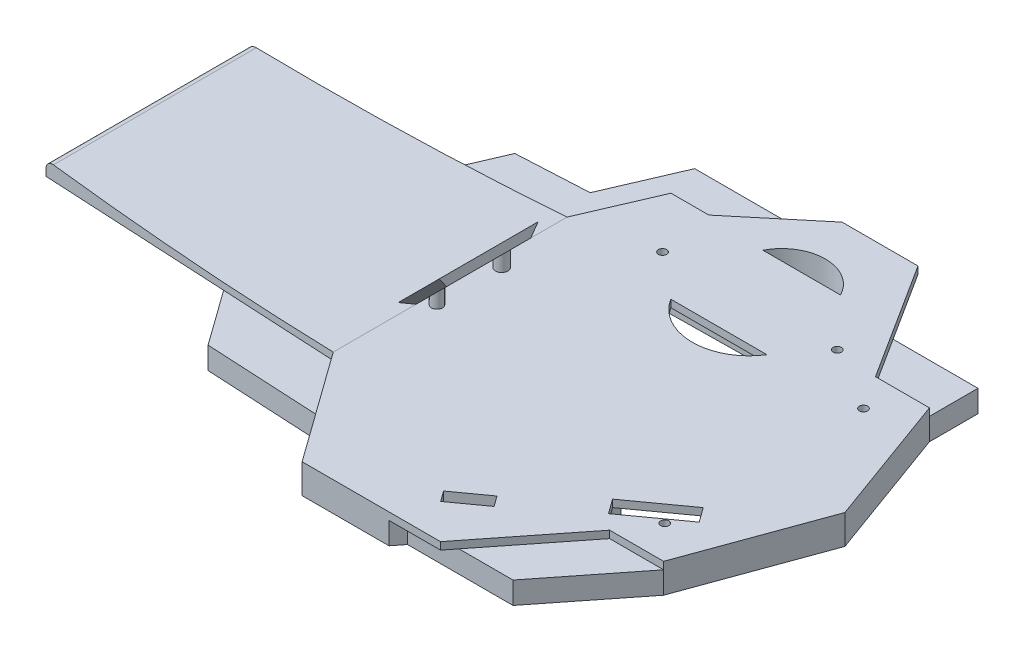
from build123d import *

# Parameters (mm, degrees)
EXTRUDE_1_DEPTH               = 2
EXTRUDE_2_DEPTH               = 2
CUT_EXTRUDE_3_DEPTH           = 202.869395429
CUT_EXTRUDE_3_DEPTH_BACK      = 202.869395429
FILLET_1_R                    = 2
EXTRUDE_4_DEPTH               = 6
CUT_EXTRUDE_7_DEPTH           = 202.98824919
EXTRUDE_5_DEPTH               = 2
EXTRUDE_5_DRAFT               = -45
EXTRUDE_11_REACH              = 204.137
SKETCH_24_R                   = 1.697293379
SKETCH_24_R_2                 = 1.5
CUT_EXTRUDE_8_DEPTH           = 203.13682253
SKETCH_26_W                   = 1.1303
SKETCH_26_H                   = 10
HOLE_WIZARD_4_40_3_AT_2_COUNT = 2
HOLE_WIZARD_4_40_3_AT_2_PITCH = 54.095245987
SKETCH_29_R                   = 3
EXTRUDE_14_DEPTH              = 5
SKETCH_32_W                   = 1.1303
SKETCH_32_H                   = 8
HOLE_WIZARD_4_40_4_AT_2_COUNT = 2
HOLE_WIZARD_4_40_4_AT_2_PITCH = 46.853089657


with BuildPart() as part:
    # 草图2 → 凸台-拉伸1 (new body)
    with BuildSketch(Plane(origin=(0, 0, 0), x_dir=(1, 0, 0), z_dir=(0, 1, 0))):
        Polygon((141.821582241, 68.082690978), (121.161879345, 68.082690978), (101.35099463, 51.608897425), (91.039832206, 51.608897425), (82.527346571, 31.825074964), (0, 27.5), (0, -27.5), (82.527346571, -31.825074964), (104.14664553, -61.917309022), (141.821582241, -61.917309022), (162.133732132, -36.18552755), (176.829545061, -36.18552755), (190, 0), (176.829545061, 36.18552755), (162.133732132, 36.18552755), align=None)
    extrude(amount=EXTRUDE_1_DEPTH)

    # 草图6 → 凸台-拉伸2 (add)
    with BuildSketch(Plane(origin=(0, 2, 0), x_dir=(1, 0, 0), z_dir=(0, 1, 0))):
        Polygon((82.527346571, 31.825074964), (82.527346571, -31.825074964), (0, -27.5), (0, 27.5), align=None)
    extrude(amount=EXTRUDE_2_DEPTH)

    # 草图7 → 切除-拉伸3 (cut, two sides: drawn at the far end of the back side and taken through both)
    with BuildSketch(Plane.XY.offset(-CUT_EXTRUDE_3_DEPTH_BACK)):
        with BuildLine():
            Line((82.527346571, 2), (82.527346571, 30.740821148))
            Line((82.527346571, 30.740821148), (0, 4))
            add(Edge.make_bspline(
                [(82.527346571, 2), (41.215261335, 1.001172546), (0, 4)],
                knots=[0, 0, 0, 1, 1, 1], degree=2))
        make_face()
    extrude(amount=CUT_EXTRUDE_3_DEPTH + CUT_EXTRUDE_3_DEPTH_BACK, mode=Mode.SUBTRACT)

    # 圆角1
    fillet_1_edges = [part.edges().sort_by_distance(p)[0] for p in [
        (0, 4, 13.75),
    ]]
    fillet(fillet_1_edges, radius=FILLET_1_R)

    # 草图13 → 凸台-拉伸4 (add)
    with BuildSketch(Plane.XZ):
        Polygon((53.501507434, -30.303895193), (58.412275987, -41.716986195), (77.926898746, -42.739704237), (86.484415452, -62.62818317), (136.164724768, -62.62818317), (144.584081331, -49.40685536), (176.829545061, -49.40685536), (176.829545061, -36.18552755), (190, 0), (176.829545061, 36.18552755), (158.743204348, 59.097615602), (130.016377906, 59.097615602), (127.790568727, 61.917309022), (104.14664553, 61.917309022), (93.336996051, 46.871191993), (61.845926158, 45.220814953), (51.036276678, 30.174697924), (171.852914921, 31.825074964), (171.852914921, -31.825074964), align=None)
    extrude(amount=EXTRUDE_4_DEPTH)

    # 草图18 → 切除-拉伸7 (cut, through all)
    with BuildSketch(Plane(origin=(0, 2, 0), x_dir=(1, 0, 0), z_dir=(0, 1, 0))):
        Polygon((169.563862496, -18.125868021), (155.218286362, -28.471875769), (158.085778721, -32.447885738), (172.431354854, -22.101877989), align=None)
        Polygon((130.302091903, -49.564637909), (132.361562224, -52.420260001), (140.814695434, -46.323873151), (138.755225113, -43.468251059), align=None)
    extrude(amount=-CUT_EXTRUDE_7_DEPTH, mode=Mode.SUBTRACT)

    # 草图17 → 切除-拉伸8 (cut, through all)
    with BuildSketch(Plane(origin=(0, 2, 0), x_dir=(1, 0, 0), z_dir=(0, 1, 0))):
        with BuildLine():
            Line((116.011181983, 26.59529287), (142.181150975, 26.59529287))
            ThreePointArc((142.181150975, 26.59529287), (129.096166479, 19.355270398), (116.011181983, 26.59529287))
        make_face()
        with BuildLine():
            Line((138.127410429, 50.681307574), (116.98958299, 50.681307574))
            ThreePointArc((116.98958299, 50.681307574), (127.55849671, 57.129732827), (138.127410429, 50.681307574))
        make_face()
    extrude(amount=-CUT_EXTRUDE_8_DEPTH, mode=Mode.SUBTRACT)

    # 草图26 → #4-40 螺纹孔3 (revolve, cut)
    with BuildSketch(Plane(origin=(168.015540482, 4, 27.047622993), x_dir=(0, 0, 1), z_dir=(1, 0, 0))):
        with Locations((0.56515, 5)):
            Rectangle(SKETCH_26_W, SKETCH_26_H)
    hole_wizard_4_40_3 = revolve(axis=Axis((168.015540482, 10.35, 27.047622993), (0, -1, 0)), mode=Mode.SUBTRACT)

    # #4-40 螺纹孔3 at 2: #4-40 螺纹孔3 ×2
    with Locations(*[(0, 0, -i * HOLE_WIZARD_4_40_3_AT_2_PITCH) for i in range(1, HOLE_WIZARD_4_40_3_AT_2_COUNT)]):
        add(hole_wizard_4_40_3, mode=Mode.SUBTRACT)

    # 草图29 → 凸台-拉伸14 (add)
    with BuildSketch(Plane.XZ):
        with Locations(Location((67.061317629, 25.566411224, 0), (0, 0, 270))):
            Circle(SKETCH_29_R)
        with Locations(Location((67.061317629, -25.566411224, 0), (0, 0, 270))):
            Circle(SKETCH_29_R)
        with Locations(Location((150.788762168, 25.939901438, 0), (0, 0, 270))):
            Circle(SKETCH_29_R)
        with Locations(Location((150.788762168, -25.939901438, 0), (0, 0, 270))):
            Circle(SKETCH_29_R)
    extrude(amount=EXTRUDE_14_DEPTH)

    # 草图32 → #4-40 螺纹孔4 (revolve, cut)
    with BuildSketch(Plane(origin=(150.596814185, 2, -37.335284881), x_dir=(0, 0, 1), z_dir=(1, 0, 0))):
        with Locations((0.56515, 4)):
            Rectangle(SKETCH_32_W, SKETCH_32_H)
    hole_wizard_4_40_4 = revolve(axis=Axis((150.596814185, 8.35, -37.335284881), (0, -1, 0)), mode=Mode.SUBTRACT)

    # #4-40 螺纹孔4 at 2: #4-40 螺纹孔4 ×2
    with Locations(*[Vector(-0.9998795871522861, 0, 0.015518092543031247) * (i * HOLE_WIZARD_4_40_4_AT_2_PITCH) for i in range(1, HOLE_WIZARD_4_40_4_AT_2_COUNT)]):
        add(hole_wizard_4_40_4, mode=Mode.SUBTRACT)


with BuildPart() as body_2:
    # 草图23 → 凸台-拉伸5 (with draft: the straight prism first)
    with BuildSketch(Plane(origin=(40.263673286, -40.263673286, 0), x_dir=(0, 0, -1), z_dir=(-0.7071067811865488, 0.7071067811865464, 0))):
        Polygon((-9.292036768, -59.769859956), (-9.292036768, -60.809778756), (-9.292036768, -71.520555916), (13.638077716, -71.520555916), (13.638077716, -59.769859956), align=None)
    extrude(amount=EXTRUDE_5_DEPTH)
    # 凸台-拉伸5: the draft: its side faces are tilted about the plane it starts from
    extrude_5_sides = [body_2.faces().sort_by_distance(p)[0] for p in [
        (85.974738189, 6.86160518, 9.292036768),
        (85.974738189, 6.86160518, -13.638077716),
        (90.129236587, 11.016103578, -2.173020474),
        (81.82023979, 2.707106781, -2.173020474),
    ]]
    draft(extrude_5_sides, Plane(origin=(40.263673286, -40.263673286, 0), x_dir=(0, 0, -1), z_dir=(-0.7071067811865488, 0.7071067811865464, 0)), EXTRUDE_5_DRAFT)


with BuildPart() as body_3:
    # 凸台-拉伸11: up to this plane
    extrude_11_end = Plane(origin=(40.263673286, -40.263673286, 0), z_dir=(0.7071067811865476, -0.7071067811865476, 0))
    # 草图24 → 凸台-拉伸11 (new, up to the surface)
    with BuildSketch(Plane(origin=(0, 2, 0), x_dir=(1, 0, 0), z_dir=(0, 1, 0)), mode=Mode.PRIVATE) as extrude_11_sk1:
        with Locations(Location((85.490261725, 11.047785882, 0), (0, 0, 180))):
            Circle(SKETCH_24_R)
    extrude_11_tool1 = split(extrude(extrude_11_sk1.sketch, amount=EXTRUDE_11_REACH, mode=Mode.PRIVATE), bisect_by=extrude_11_end, keep=Keep.BOTH, mode=Mode.PRIVATE)
    add(extrude_11_tool1.solids().sort_by_distance((85.490262, 2, -11.047786))[0])
    # 草图24 → 凸台-拉伸11 (new, up to the surface)
    with BuildSketch(Plane(origin=(0, 2, 0), x_dir=(1, 0, 0), z_dir=(0, 1, 0)), mode=Mode.PRIVATE) as extrude_11_sk2:
        with Locations(Location((85.490261725, -6.54134788, 0), (0, 0, 180))):
            Circle(SKETCH_24_R_2)
    extrude_11_tool2 = split(extrude(extrude_11_sk2.sketch, amount=EXTRUDE_11_REACH, mode=Mode.PRIVATE), bisect_by=extrude_11_end, keep=Keep.BOTH, mode=Mode.PRIVATE)
    add(extrude_11_tool2.solids().sort_by_distance((85.490262, 2, 6.541348))[0])


solid = Compound([part.part, body_2.part, body_3.part])
